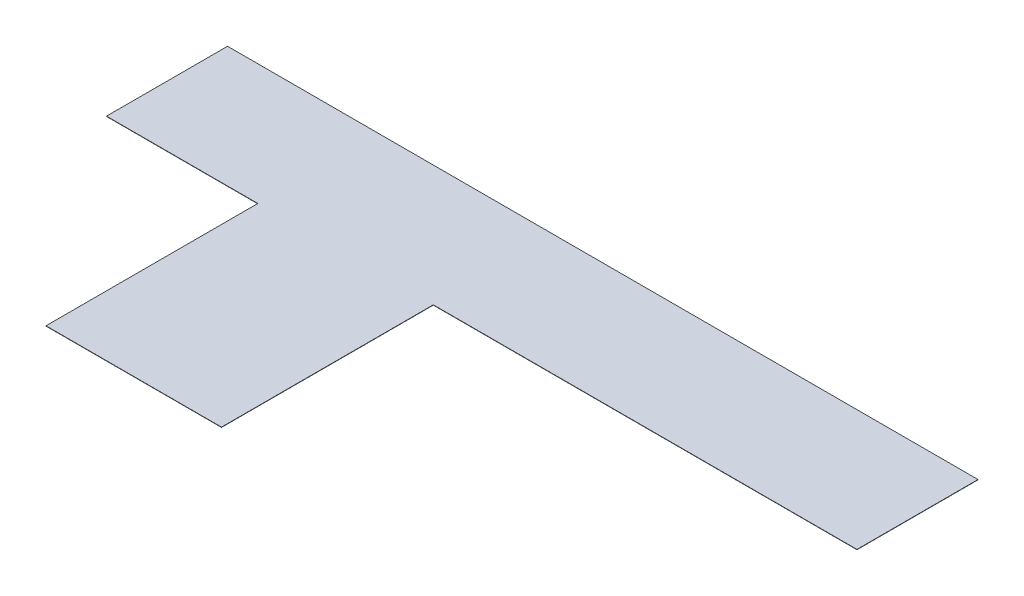
from build123d import *

# Parameters (mm, degrees)
BOSS_EXTRUDE1_DEPTH = 5


with BuildPart() as part:
    # Sketch1 → Boss-Extrude1 (new body)
    with BuildSketch(Plane(origin=(0, 0, 0), x_dir=(1, 0, 0), z_dir=(0, 1, 0))):
        Polygon((-3700, -1000), (-6200, -1000), (-6200, 1000), (6200, 1000), (6200, -1000), (-800, -1000), (-800, -4500), (-3700, -4500), align=None)
    extrude(amount=BOSS_EXTRUDE1_DEPTH)


solid = part.part
